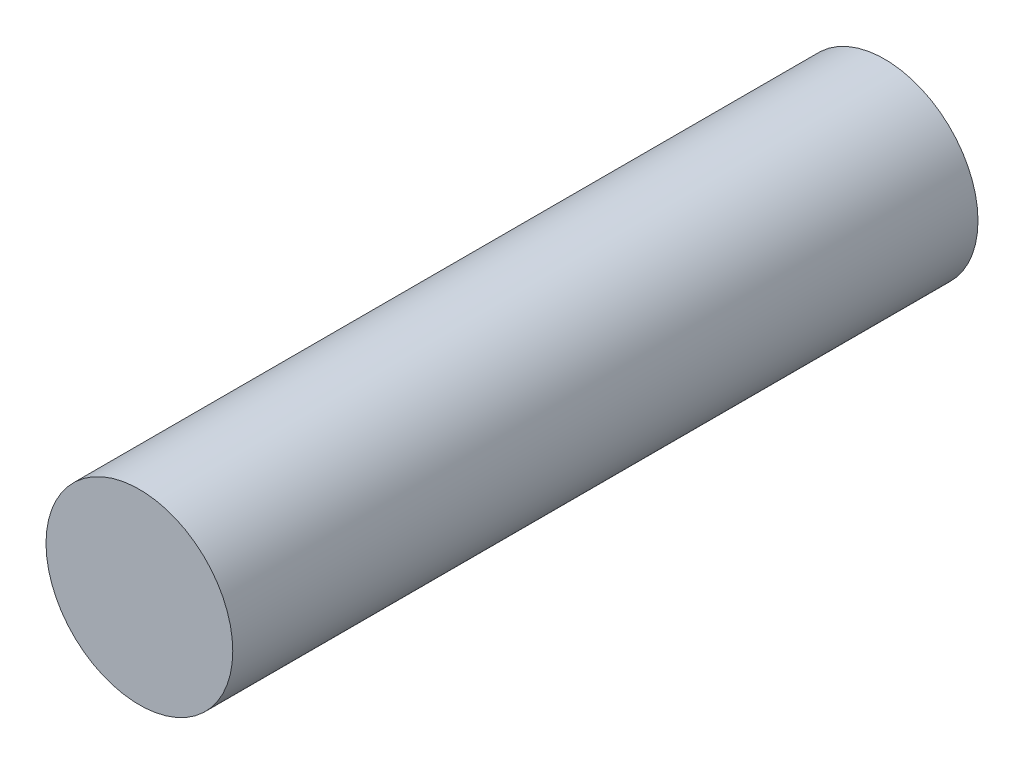
from build123d import *

# Parameters (mm, degrees)
SKETCH1_R           = 6.35
BOSS_EXTRUDE1_DEPTH = 50.673


with BuildPart() as part:
    # Sketch1 → Boss-Extrude1 (new body)
    with BuildSketch(Plane.XY):
        Circle(SKETCH1_R)
    extrude(amount=BOSS_EXTRUDE1_DEPTH)


solid = part.part
